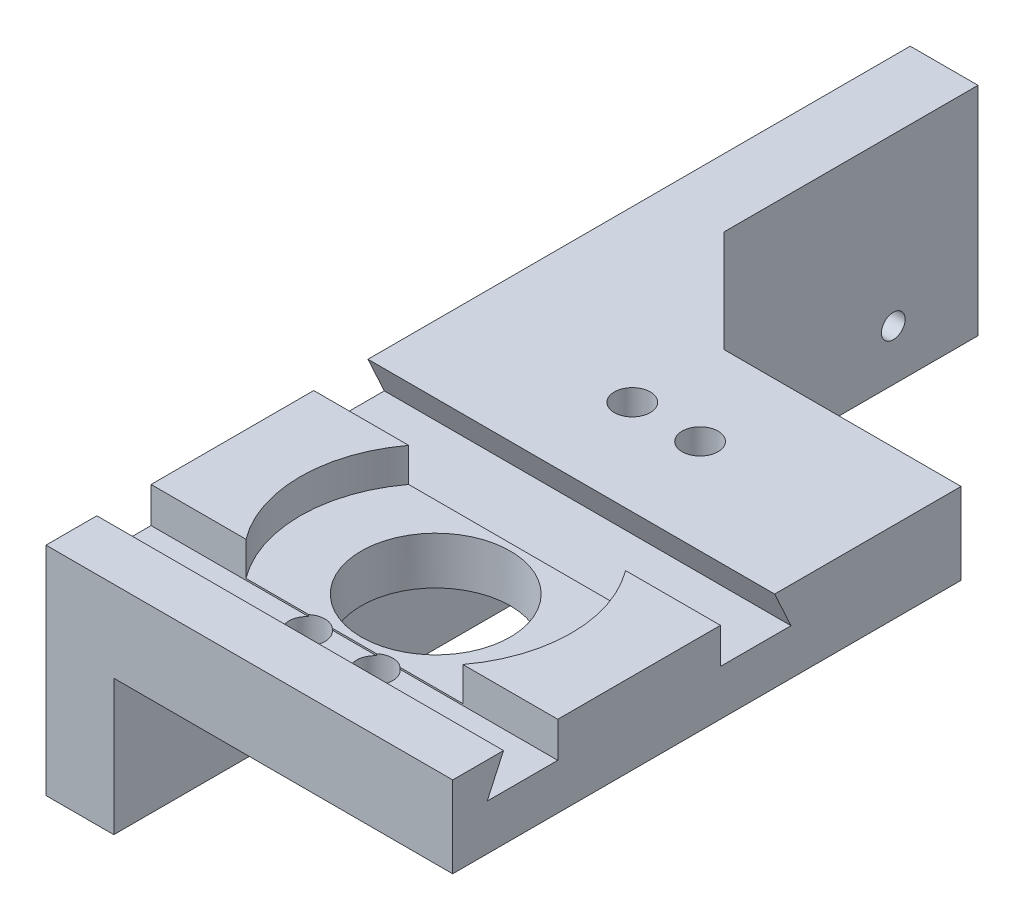
from build123d import *

# Parameters (mm, degrees)
SKETCH1_W           = 60
SKETCH1_H           = 75
BOSS_EXTRUDE1_DEPTH = 12
SKETCH6_W           = 8.75
SKETCH6_H           = 8
BOSS_EXTRUDE2_DEPTH = 9
SKETCH3_R           = 2.65
SKETCH3_R_2         = 11
CUT_EXTRUDE4_DEPTH  = 53.414215629
SKETCH5_R           = 2.65
SKETCH5_R_2         = 11
CUT_EXTRUDE8_DEPTH  = 5
DOVE_CUT_DEPTH      = 58.447802395
DOVE_CUT_DEPTH_BACK = 58.447802395
BOSS_EXTRUDE3_DEPTH = 10
CHAMFER1_SIZE       = 15
SKETCH16_R          = 1.75
CUT_EXTRUDE9_DEPTH  = 105.880884817


with BuildPart() as part:
    # Sketch1 → Boss-Extrude1 (new body)
    with BuildSketch(Plane(origin=(0, 0, 0), x_dir=(1, 0, 0), z_dir=(0, 1, 0))):
        Rectangle(SKETCH1_W, SKETCH1_H)
    extrude(amount=BOSS_EXTRUDE1_DEPTH)

    # Sketch6 → Boss-Extrude2 (add)
    with BuildSketch(Plane.XZ):
        with Locations((-5.625, -24)):
            Rectangle(SKETCH6_W, SKETCH6_H)
        with Locations((5.625, -24)):
            Rectangle(SKETCH6_W, SKETCH6_H)
        with Locations((-5.625, 24)):
            Rectangle(SKETCH6_W, SKETCH6_H)
        with Locations((5.625, 24)):
            Rectangle(SKETCH6_W, SKETCH6_H)
    extrude(amount=BOSS_EXTRUDE2_DEPTH)

    # Sketch3 → Cut-Extrude4 (cut, through all)
    with BuildSketch(Plane(origin=(0, 12, 0), x_dir=(1, 0, 0), z_dir=(0, 1, 0))):
        with Locations((-5, 24)):
            Circle(SKETCH3_R)
        with Locations((5, 24)):
            Circle(SKETCH3_R)
        with Locations((5, -24)):
            Circle(SKETCH3_R)
        with Locations((-5, -24)):
            Circle(SKETCH3_R)
        with Locations((0, -10)):
            Circle(SKETCH3_R_2)
    extrude(amount=-CUT_EXTRUDE4_DEPTH, mode=Mode.SUBTRACT)

    # Sketch5 → Cut-Extrude8 (cut)
    with BuildSketch(Plane(origin=(0, 12, 0), x_dir=(1, 0, 0), z_dir=(0, 1, 0))):
        with BuildLine():
            ThreePointArc((10, -27.320508076), (17.320508076, -20), (20, -10))
            ThreePointArc((20, -10), (10, 7.320508076), (-10, 7.320508076))
            ThreePointArc((-10, 7.320508076), (-17.320508076, 0), (-20, -10))
            ThreePointArc((-20, -10), (-10, -27.320508076), (10, -27.320508076))
        make_face()
        with Locations((-5, -24)):
            Circle(SKETCH5_R, mode=Mode.SUBTRACT)
        with Locations((5, -24)):
            Circle(SKETCH5_R, mode=Mode.SUBTRACT)
        with Locations((0, -10)):
            Circle(SKETCH5_R_2, mode=Mode.SUBTRACT)
    extrude(amount=-CUT_EXTRUDE8_DEPTH, mode=Mode.SUBTRACT)

    # Sketch15 → Dove Cut (cut, two sides: drawn at the far end of the back side and taken through both)
    with BuildSketch(Plane(origin=(0, 0, 10), x_dir=(0, 0, 1), z_dir=(-1, 0, 0)).offset(-DOVE_CUT_DEPTH_BACK)):
        Polygon((-21.91084373, 6.75), (-12, 6.75), (-12, 12), (-20, 12), (-22.41084373, 6.75), align=None)
        Polygon((12, 12), (20, 12), (22.41084373, 6.75), (21.91084373, 6.75), (12, 6.75), align=None)
    extrude(amount=DOVE_CUT_DEPTH + DOVE_CUT_DEPTH_BACK, mode=Mode.SUBTRACT)

    # Sketch8 → Boss-Extrude3 (add)
    with BuildSketch(Plane(origin=(-30, 30, 0), x_dir=(0, 1, 0), z_dir=(1, 0, 0))):
        Polygon((-30, 37.5), (-50, 37.5), (-50, -90), (-30, -90), (-18, -90), (-18, -37.5), (-30, -37.5), align=None)
    extrude(amount=BOSS_EXTRUDE3_DEPTH)

    # Chamfer1
    chamfer1_edges = [part.edges().sort_by_distance(p)[0] for p in [
        (-20, 6, -37.5),
    ]]
    chamfer(chamfer1_edges, length=CHAMFER1_SIZE)

    # Sketch16 → Cut-Extrude9 (cut, through all)
    with BuildSketch(Plane(origin=(-20, 0, 0), x_dir=(0, 0, -1), z_dir=(1, 0, 0))):
        with Locations((77.5, -12.5)):
            Circle(SKETCH16_R)
        with Locations((32.5, -12.5)):
            Circle(SKETCH16_R)
    extrude(amount=-CUT_EXTRUDE9_DEPTH, mode=Mode.SUBTRACT)


solid = part.part
